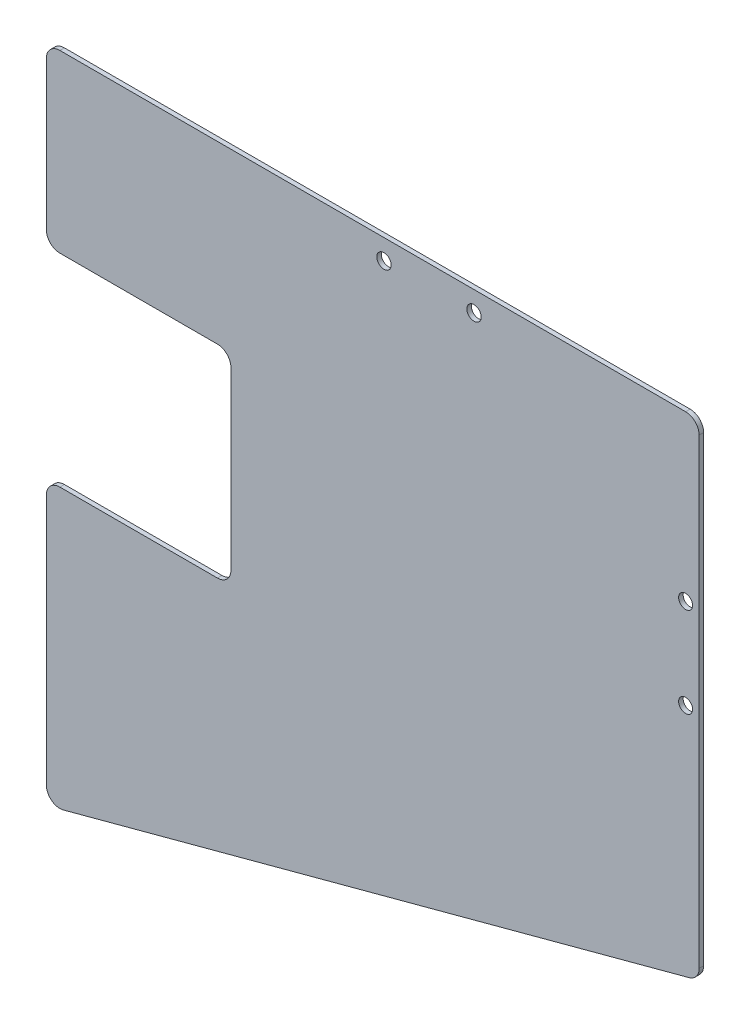
from build123d import *

# Parameters (mm, degrees)
SKETCH_1_W          = 145
SKETCH_1_H          = 152
EXTRUDE_1_DEPTH     = 1
SKETCH_2_W          = 41
SKETCH_2_H          = 45
CUT_EXTRUDE_1_DEPTH = 1
SKETCH_3_R          = 1.6
CUT_EXTRUDE_2_DEPTH = 1
FILLET_1_R          = 3
SKETCH_7_R          = 1.55
CUT_EXTRUDE_6_DEPTH = 10


with BuildPart() as part:
    # 草图1 → 凸台-拉伸1 (new body)
    with BuildSketch(Plane.XY):
        Rectangle(SKETCH_1_W, SKETCH_1_H)
    extrude(amount=EXTRUDE_1_DEPTH)

    # 草图2 → 切除-拉伸1 (cut)
    with BuildSketch(Plane(origin=(0, 0, 0), x_dir=(-1, 0, 0), z_dir=(0, 0, -1))):
        with Locations((52, 14.5)):
            Rectangle(SKETCH_2_W, SKETCH_2_H)
        Polygon((-72.5, -31.894171459), (72.5, -70.746804361), (72.5, -76), (-72.5, -76), align=None)
    extrude(amount=-CUT_EXTRUDE_1_DEPTH, mode=Mode.SUBTRACT)

    # 草图3 → 切除-拉伸2 (cut)
    with BuildSketch(Plane.XY.offset(1)):
        with Locations((2.5, 71.5)):
            Circle(SKETCH_3_R)
        with Locations((22.5, 71.5)):
            Circle(SKETCH_3_R)
    extrude(amount=-CUT_EXTRUDE_2_DEPTH, mode=Mode.SUBTRACT)

    # 圆角1
    fillet_1_edges = [part.edges().sort_by_distance(p)[0] for p in [
        (72.5, -31.894171459, 0.5),
        (-72.5, -70.746804361, 0.5),
        (-72.5, -8, 0.5),
        (-31.5, -8, 0.5),
        (-31.5, 37, 0.5),
        (-72.5, 37, 0.5),
        (-72.5, 76, 0.5),
        (72.5, 76, 0.5),
    ]]
    fillet(fillet_1_edges, radius=FILLET_1_R)

    # 草图7 → 切除-拉伸6 (cut)
    with BuildSketch(Plane(origin=(0, 0, 0), x_dir=(-1, 0, 0), z_dir=(0, 0, -1))):
        with Locations((-69.5, 39.5)):
            Circle(SKETCH_7_R)
        with Locations((-69.5, 19.5)):
            Circle(SKETCH_7_R)
    extrude(amount=-CUT_EXTRUDE_6_DEPTH, mode=Mode.SUBTRACT)


solid = part.part
